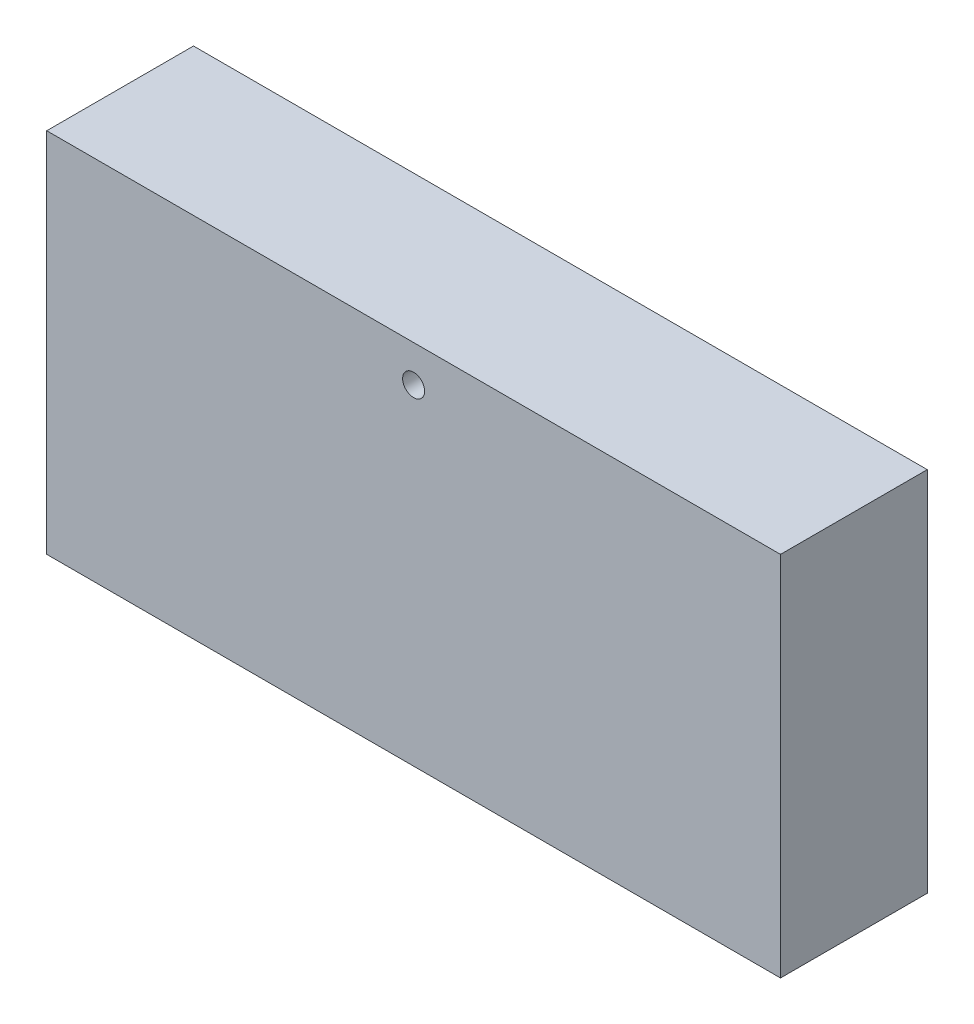
from build123d import *

# Parameters (mm, degrees)
SKETCH1_W           = 100
SKETCH1_H           = 50
SKETCH1_R           = 1.5
BOSS_EXTRUDE1_DEPTH = 20


with BuildPart() as part:
    # Sketch1 → Boss-Extrude1 (new body)
    with BuildSketch(Plane.XY):
        Rectangle(SKETCH1_W, SKETCH1_H)
        with Locations((0, 20)):
            Circle(SKETCH1_R, mode=Mode.SUBTRACT)
    extrude(amount=BOSS_EXTRUDE1_DEPTH)


solid = part.part
